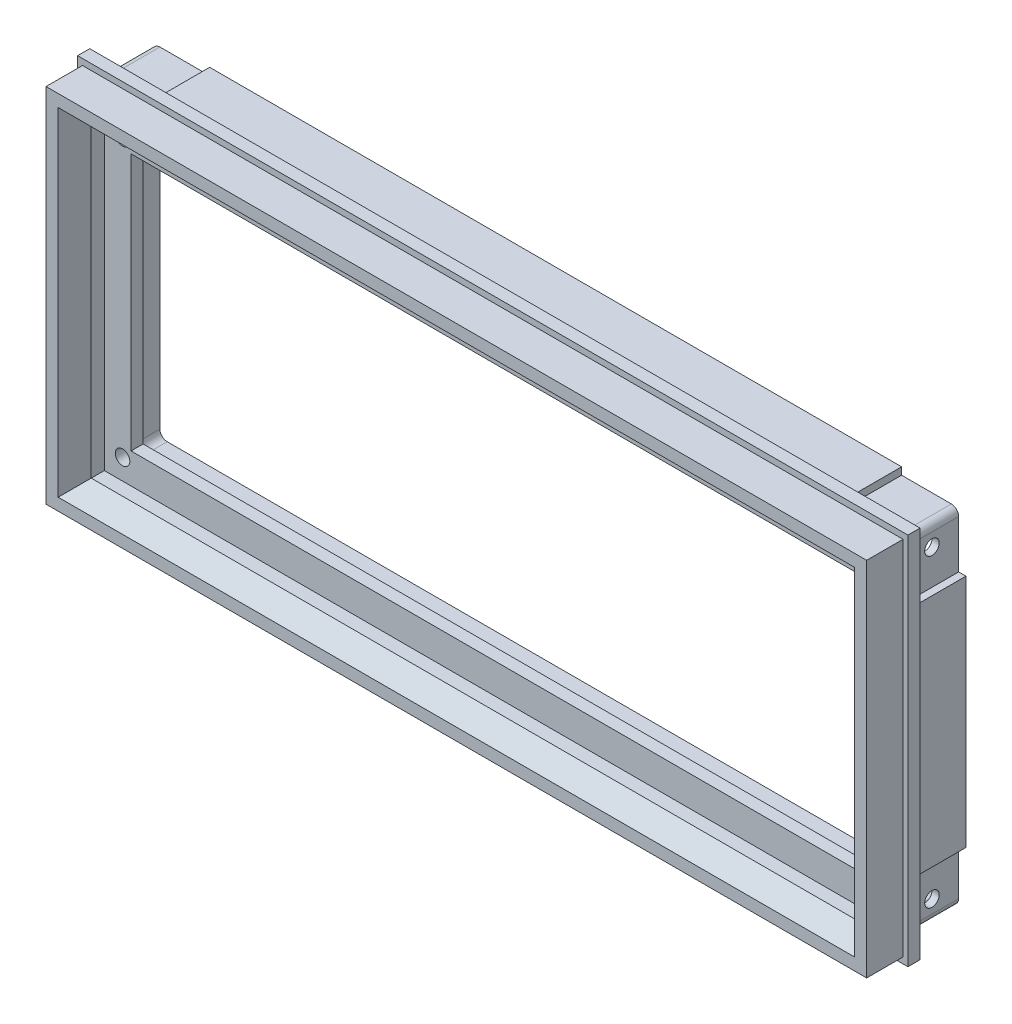
from build123d import *

# Parameters (mm, degrees)
ESQUISSE1_W             = 171
ESQUISSE1_H             = 77
ESQUISSE1_R             = 1.5
ESQUISSE1_W_2           = 149
ESQUISSE1_H_2           = 53
BOSS_EXTRU_1_DEPTH      = 2.5
ESQUISSE2_W             = 169
ESQUISSE2_H             = 74.5
ESQUISSE2_W_2           = 160
ESQUISSE2_H_2           = 65.5
BOSS_EXTRU_2_DEPTH      = 7.5
CHANFREIN7_SIZE         = 2
CHANFREIN7_SIZE2        = 4.802328779
ESQUISSE4_W             = 142.5
ESQUISSE4_H             = 1.5
ESQUISSE4_W_2           = 1.5
ESQUISSE4_H_2           = 48.4
BOSS_EXTRU_3_DEPTH      = 10.45
ESQUISSE5_R             = 1.5
ENL_V_MAT_EXTRU_1_DEPTH = 186.554446188


with BuildPart() as part:
    # Esquisse1 → Boss.-Extru.1 (new body)
    with BuildSketch(Plane.XY):
        with Locations((85.5, -38.5)):
            Rectangle(ESQUISSE1_W, ESQUISSE1_H)
        with Locations((9.25, -10)):
            Circle(ESQUISSE1_R, mode=Mode.SUBTRACT)
        with Locations((161.75, -10)):
            Circle(ESQUISSE1_R, mode=Mode.SUBTRACT)
        with Locations((161.75, -67)):
            Circle(ESQUISSE1_R, mode=Mode.SUBTRACT)
        with Locations((9.25, -67)):
            Circle(ESQUISSE1_R, mode=Mode.SUBTRACT)
        with Locations((85.5, -38.5)):
            Rectangle(ESQUISSE1_W_2, ESQUISSE1_H_2, mode=Mode.SUBTRACT)
    extrude(amount=BOSS_EXTRU_1_DEPTH)

    # Esquisse2 → Boss.-Extru.2 (add)
    with BuildSketch(Plane.XY.offset(2.5)):
        with Locations((85.5, -38.5)):
            Rectangle(ESQUISSE2_W, ESQUISSE2_H)
        with Locations((85.5, -38.5)):
            Rectangle(ESQUISSE2_W_2, ESQUISSE2_H_2, mode=Mode.SUBTRACT)
    extrude(amount=BOSS_EXTRU_2_DEPTH)

    # Chanfrein7
    chanfrein7_edges = [part.edges().sort_by_distance(p)[0] for p in [
        (5.5, -38.5, 10),
        (85.5, -71.25, 10),
        (165.5, -38.5, 10),
        (85.5, -5.75, 10),
    ]]
    chanfrein7_side = [part.faces().sort_by_distance(p)[0] for p in [
        (85.5, -3.096923117, 10),
    ]]
    chamfer(chanfrein7_edges, length=CHANFREIN7_SIZE, length2=CHANFREIN7_SIZE2, reference=chanfrein7_side[0])

    # Esquisse4 → Boss.-Extru.3 (add)
    # profile 1 of 5: a face of its own
    with BuildSketch(Plane(origin=(0, 0, 0), x_dir=(-1, 0, 0), z_dir=(0, 0, -1))):
        with BuildLine():
            Line((-167, -2.925), (-4, -2.925))
            ThreePointArc((-4, -2.925), (-2.939339828, -3.364339828), (-2.5, -4.425))
            Line((-2.5, -4.425), (-2.5, -72.575))
            ThreePointArc((-2.5, -72.575), (-2.939339828, -73.635660172), (-4, -74.075))
            Line((-4, -74.075), (-167, -74.075))
            ThreePointArc((-167, -74.075), (-168.060660172, -73.635660172), (-168.5, -72.575))
            Line((-168.5, -72.575), (-168.5, -4.425))
            ThreePointArc((-168.5, -4.425), (-168.060660172, -3.364339828), (-167, -2.925))
        make_face()
        with BuildLine():
            Line((-167, -5.925), (-167, -71.075))
            ThreePointArc((-167, -71.075), (-166.560660172, -72.135660172), (-165.5, -72.575))
            Line((-165.5, -72.575), (-5.5, -72.575))
            ThreePointArc((-5.5, -72.575), (-4.439339828, -72.135660172), (-4, -71.075))
            Line((-4, -71.075), (-4, -5.925))
            ThreePointArc((-4, -5.925), (-4.439339828, -4.864339828), (-5.5, -4.425))
            Line((-5.5, -4.425), (-165.5, -4.425))
            ThreePointArc((-165.5, -4.425), (-166.560660172, -4.864339828), (-167, -5.925))
        make_face(mode=Mode.SUBTRACT)
    # profile 2 of 5: a face of its own
    with BuildSketch(Plane(origin=(0, 0, 0), x_dir=(-1, 0, 0), z_dir=(0, 0, -1))):
        with Locations((-85.5, -2.175)):
            Rectangle(ESQUISSE4_W, ESQUISSE4_H)
    # profile 3 of 5: a face of its own
    with BuildSketch(Plane(origin=(0, 0, 0), x_dir=(-1, 0, 0), z_dir=(0, 0, -1))):
        with Locations((-169.25, -38.5)):
            Rectangle(ESQUISSE4_W_2, ESQUISSE4_H_2)
    # profile 4 of 5: a face of its own
    with BuildSketch(Plane(origin=(0, 0, 0), x_dir=(-1, 0, 0), z_dir=(0, 0, -1))):
        with Locations((-85.5, -74.825)):
            Rectangle(ESQUISSE4_W, ESQUISSE4_H)
    # profile 5 of 5: a face of its own
    with BuildSketch(Plane(origin=(0, 0, 0), x_dir=(-1, 0, 0), z_dir=(0, 0, -1))):
        with Locations((-1.75, -38.5)):
            Rectangle(ESQUISSE4_W_2, ESQUISSE4_H_2)
    extrude(amount=BOSS_EXTRU_3_DEPTH)

    # Esquisse5 → Enlèv. mat.-Extru.1 (cut, through all)
    with BuildSketch(Plane(origin=(168.5, 0, 0), x_dir=(0, 0, -1), z_dir=(1, 0, 0))):
        with Locations(Location((4.95, -7.125, 0), (0, 0, 53.130102354))):
            Circle(ESQUISSE5_R)
        with Locations((4.95, -69.875)):
            Circle(ESQUISSE5_R)
    extrude(amount=-ENL_V_MAT_EXTRU_1_DEPTH, mode=Mode.SUBTRACT)


solid = part.part
